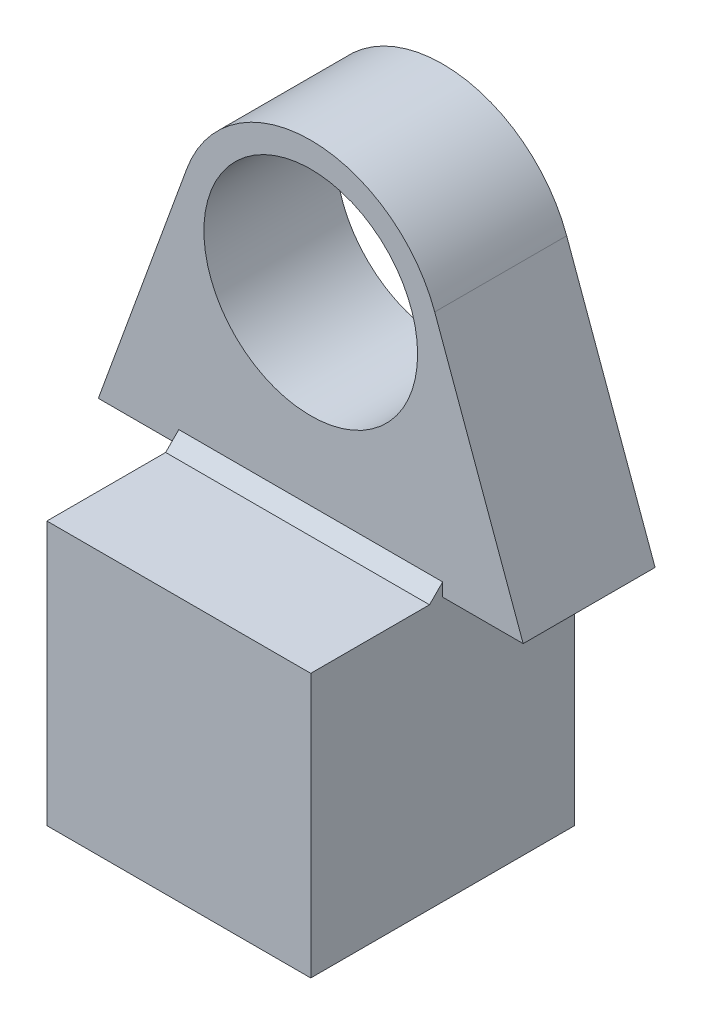
from build123d import *

# Parameters (mm, degrees)
SKETCH_1_R      = 10
SKETCH_1_R_2    = 8.1
EXTRUDE_1_DEPTH = 10
SKETCH_2_R      = 8.1
SKETCH_2_R_2    = 6.6
EXTRUDE_2_DEPTH = 10
SKETCH_3_W      = 20
SKETCH_3_H      = 20
EXTRUDE_3_DEPTH = 20
SKETCH1_W       = 32.202662478
SKETCH1_H       = 25
EXTRUDE1_DEPTH  = 10
CHAMFER1_SIZE   = 1


with BuildPart() as part:
    # 스케치1 → 보스-돌출1 (new, symmetric)
    # profile 1 of 2: a face of its own
    with BuildSketch(Plane.XY):
        Circle(SKETCH_1_R)
        Circle(SKETCH_1_R_2, mode=Mode.SUBTRACT)
    # profile 2 of 2: a face of its own
    with BuildSketch(Plane.XY):
        with BuildLine():
            Line((-9.396926208, 3.420201433), (-16.101331239, -15))
            Line((-16.101331239, -15), (16.101331239, -15))
            Line((16.101331239, -15), (9.396926208, 3.420201433))
            ThreePointArc((9.396926208, 3.420201433), (9.84807753, 1.736481777), (10, 0))
            ThreePointArc((10, 0), (-1.736481777, -9.84807753), (-9.396926208, 3.420201433))
        make_face()
    extrude(amount=EXTRUDE_1_DEPTH, both=True)

    # 스케치2 → 보스-돌출2 (add)
    with BuildSketch(Plane.XY):
        Circle(SKETCH_2_R)
        Circle(SKETCH_2_R_2, mode=Mode.SUBTRACT)
    extrude(amount=EXTRUDE_2_DEPTH)

    # 스케치3 → 보스-돌출3 (add)
    with BuildSketch(Plane.XZ.offset(15)):
        Rectangle(SKETCH_3_W, SKETCH_3_H)
    extrude(amount=EXTRUDE_3_DEPTH)

    # Sketch1 → Extrude1 (cut)
    with BuildSketch(Plane.XY.offset(10)):
        with Locations((0, -2.5)):
            Rectangle(SKETCH1_W, SKETCH1_H)
    extrude(amount=-EXTRUDE1_DEPTH, mode=Mode.SUBTRACT)

    # Chamfer1
    chamfer1_edges = [part.edges().sort_by_distance(p)[0] for p in [
        (0, -15, 0),
    ]]
    chamfer(chamfer1_edges, length=CHAMFER1_SIZE)


solid = part.part
